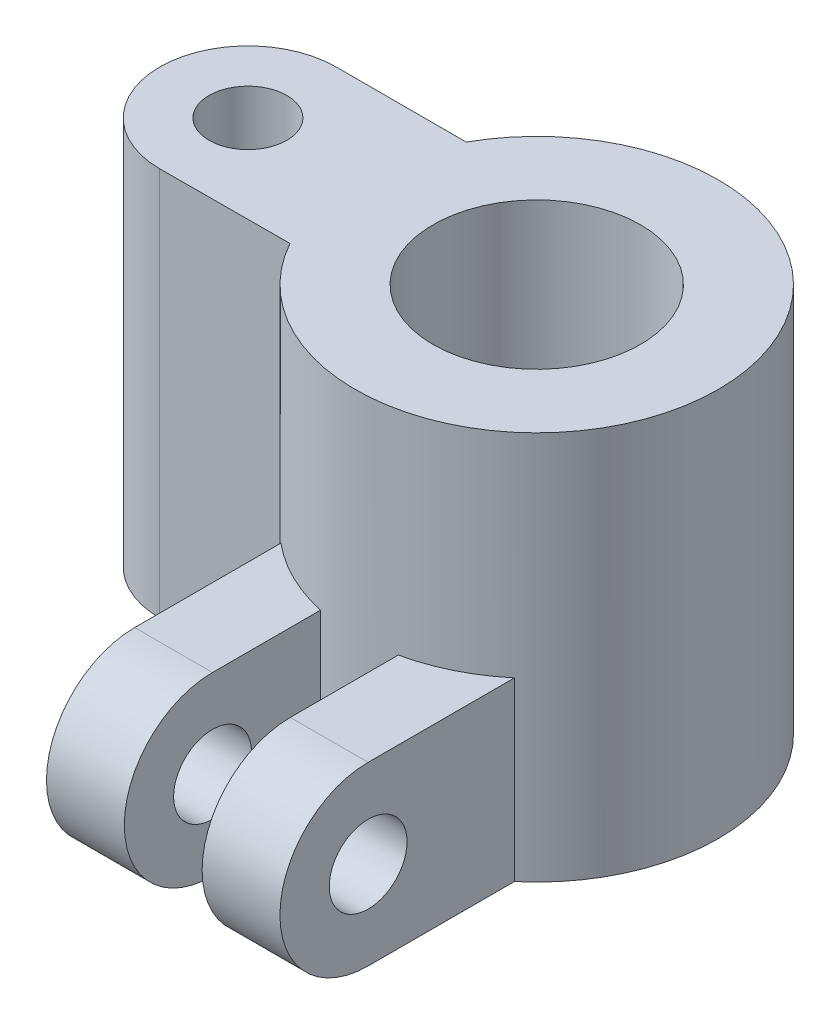
from build123d import *

# Parameters (mm, degrees)
SKETCH1_R           = 7.5
SKETCH1_R_2         = 20
BOSS_EXTRUDE1_DEPTH = 75
BOSS_EXTRUDE2_DEPTH = 34
CUT_EXTRUDE1_REACH  = 120.808
SKETCH2_R           = 7.5
CUT_EXTRUDE2_REACH  = 142.947
SKETCH3_R           = 7.5


with BuildPart() as part:
    # Sketch1 → Boss-Extrude1 (new body)
    with BuildSketch(Plane(origin=(0, 0, 0), x_dir=(1, 0, 0), z_dir=(0, 1, 0))):
        with BuildLine():
            Line((-30.594117082, 17), (-55.668329577, 17))
            ThreePointArc((-55.668329577, 17), (-72.668329577, 0), (-55.668329577, -17))
            Line((-55.668329577, -17), (-30.643296936, -16.911190168))
            ThreePointArc((-30.643296936, -16.911190168), (34.999963193, -0.050758852), (-30.594117082, 17))
        make_face()
        with Locations((-55.668329577, 0)):
            Circle(SKETCH1_R, mode=Mode.SUBTRACT)
        Circle(SKETCH1_R_2, mode=Mode.SUBTRACT)
    extrude(amount=BOSS_EXTRUDE1_DEPTH)

    # Sketch1<4> → Boss-Extrude2 (add)
    with BuildSketch(Plane(origin=(0, 0, 0), x_dir=(1, 0, 0), z_dir=(0, 1, 0))):
        with BuildLine():
            Line((22.5, -72), (22.5, -26.809513237))
            ThreePointArc((22.5, -26.809513237), (15.446901808, -31.406897722), (7.5, -34.186985828))
            Line((7.5, -34.186985828), (7.5, -72))
            Line((7.5, -72), (22.5, -72))
        make_face()
        with BuildLine():
            ThreePointArc((-7.5, -34.186985828), (-15.446901808, -31.406897722), (-22.5, -26.809513237))
            Line((-22.5, -26.809513237), (-22.5, -72))
            Line((-22.5, -72), (-7.5, -72))
            Line((-7.5, -72), (-7.5, -34.186985828))
        make_face()
    extrude(amount=BOSS_EXTRUDE2_DEPTH)

    # Sketch2 → Cut-Extrude1 (cut, up to next)
    with BuildSketch(Plane.ZY.offset(22.5), mode=Mode.PRIVATE) as cut_extrude1_sk1:
        with BuildLine():
            Line((72, 0), (72, 17))
            ThreePointArc((72, 17), (67.02081528, 4.97918472), (55, 0))
            Line((55, 0), (72, 0))
        make_face()
    cut_extrude1_tool1 = extrude(cut_extrude1_sk1.sketch, amount=-CUT_EXTRUDE1_REACH, mode=Mode.PRIVATE) & part.part
    # Sketch2 → Cut-Extrude1 (cut, up to next)
    with BuildSketch(Plane.ZY.offset(22.5), mode=Mode.PRIVATE) as cut_extrude1_sk2:
        with BuildLine():
            Line((72, 34), (55, 34))
            ThreePointArc((55, 34), (67.02081528, 29.02081528), (72, 17))
            Line((72, 17), (72, 34))
        make_face()
    cut_extrude1_tool2 = extrude(cut_extrude1_sk2.sketch, amount=-CUT_EXTRUDE1_REACH, mode=Mode.PRIVATE) & part.part
    # Sketch2 → Cut-Extrude1 (cut, up to next)
    with BuildSketch(Plane.ZY.offset(22.5), mode=Mode.PRIVATE) as cut_extrude1_sk3:
        with Locations((55, 17)):
            Circle(SKETCH2_R)
    cut_extrude1_tool3 = extrude(cut_extrude1_sk3.sketch, amount=-CUT_EXTRUDE1_REACH, mode=Mode.PRIVATE) & part.part
    add(cut_extrude1_tool1.solids().sort_by_distance((-22.5, 3.797255, 68.202745))[0], mode=Mode.SUBTRACT)
    add(cut_extrude1_tool2.solids().sort_by_distance((-22.5, 30.202745, 68.202745))[0], mode=Mode.SUBTRACT)
    add(cut_extrude1_tool3.solids().sort_by_distance((-22.5, 17, 55))[0], mode=Mode.SUBTRACT)

    # Sketch3 → Cut-Extrude2 (cut, up to next)
    with BuildSketch(Plane(origin=(22.5, 0, 0), x_dir=(0, 0, -1), z_dir=(1, 0, 0)), mode=Mode.PRIVATE) as cut_extrude2_sk1:
        with BuildLine():
            ThreePointArc((-72, 17), (-67.02081528, 29.02081528), (-55, 34))
            Line((-55, 34), (-72, 34))
            Line((-72, 34), (-72, 17))
        make_face()
    cut_extrude2_tool1 = extrude(cut_extrude2_sk1.sketch, amount=-CUT_EXTRUDE2_REACH, mode=Mode.PRIVATE) & part.part
    # Sketch3 → Cut-Extrude2 (cut, up to next)
    with BuildSketch(Plane(origin=(22.5, 0, 0), x_dir=(0, 0, -1), z_dir=(1, 0, 0)), mode=Mode.PRIVATE) as cut_extrude2_sk2:
        with BuildLine():
            ThreePointArc((-55, 0), (-67.02081528, 4.97918472), (-72, 17))
            Line((-72, 17), (-72, 0))
            Line((-72, 0), (-55, 0))
        make_face()
    cut_extrude2_tool2 = extrude(cut_extrude2_sk2.sketch, amount=-CUT_EXTRUDE2_REACH, mode=Mode.PRIVATE) & part.part
    # Sketch3 → Cut-Extrude2 (cut, up to next)
    with BuildSketch(Plane(origin=(22.5, 0, 0), x_dir=(0, 0, -1), z_dir=(1, 0, 0)), mode=Mode.PRIVATE) as cut_extrude2_sk3:
        with Locations((-55, 17)):
            Circle(SKETCH3_R)
    cut_extrude2_tool3 = extrude(cut_extrude2_sk3.sketch, amount=-CUT_EXTRUDE2_REACH, mode=Mode.PRIVATE) & part.part
    add(cut_extrude2_tool1.solids().sort_by_distance((22.5, 30.202745, 68.202745))[0], mode=Mode.SUBTRACT)
    add(cut_extrude2_tool2.solids().sort_by_distance((22.5, 3.797255, 68.202745))[0], mode=Mode.SUBTRACT)
    add(cut_extrude2_tool3.solids().sort_by_distance((22.5, 17, 55))[0], mode=Mode.SUBTRACT)


solid = part.part
